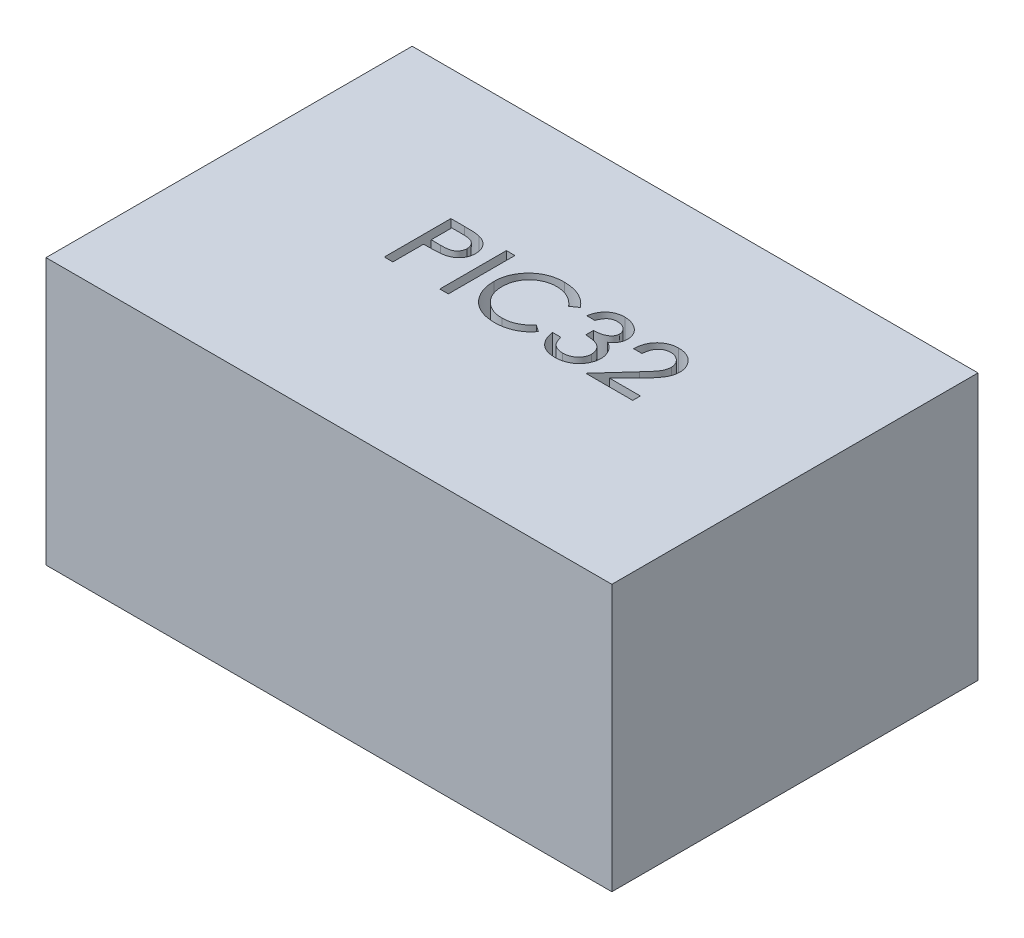
from build123d import *

# Parameters (mm, degrees)
SKETCH1_W           = 53.975
SKETCH1_H           = 34.925
BOSS_EXTRUDE1_DEPTH = 25.4
SKETCH2_W           = 0.814102564
SKETCH2_H           = 6.35
CUT_EXTRUDE1_DEPTH  = 12.7


with BuildPart() as part:
    # Sketch1 → Boss-Extrude1 (new body)
    with BuildSketch(Plane(origin=(0, 0, 0), x_dir=(1, 0, 0), z_dir=(0, 1, 0))):
        Rectangle(SKETCH1_W, SKETCH1_H)
    extrude(amount=BOSS_EXTRUDE1_DEPTH)

    # Sketch2 → Cut-Extrude1 (cut, symmetric)
    # profile 1 of 5: a face of its own
    with BuildSketch(Plane(origin=(0, 25.4, 0), x_dir=(1, 0, 0), z_dir=(0, 1, 0))):
        with BuildLine():
            Line((-10.902195921, 5.074435246), (-9.600903853, 5.074435246))
            add(Edge.make_bspline(
                [(-9.600903853, 5.074435246), (-9.514824462, 5.074388351), (-9.349857019, 5.07429848), (-9.113276063, 5.068208505), (-8.898643863, 5.062952351), (-8.705643287, 5.052849575), (-8.534713751, 5.039010709), (-8.385793895, 5.02273786), (-8.258723822, 5.0044354), (-8.182090609, 4.987888516), (-8.146967555, 4.980304637)],
                knots=[0, 0, 0, 0, 1.415450773, 2.712650385, 3.891531898, 4.945867971, 5.890285756, 6.71109784, 7.409261617, 8, 8, 8, 8], degree=3))
            add(Edge.make_bspline(
                [(-8.146967555, 4.980304637), (-8.097523531, 4.967589826), (-7.999985627, 4.942507403), (-7.860551564, 4.89080511), (-7.728247474, 4.832056113), (-7.603525068, 4.765227141), (-7.487658334, 4.688043262), (-7.378147508, 4.604184186), (-7.278360977, 4.509408439), (-7.184880136, 4.408313803), (-7.102859509, 4.298591196), (-7.029368789, 4.1839533), (-6.96845616, 4.062735032), (-6.918396285, 3.935387282), (-6.879262671, 3.802574016), (-6.851113297, 3.663872069), (-6.834198642, 3.519585595), (-6.832531973, 3.421259693), (-6.8316831, 3.371180037)],
                knots=[0, 0, 0, 0, 1.085641105, 2.141637125, 3.15936318, 4.164535163, 5.147931294, 6.118832473, 7.09541784, 8.072503165, 9.045079613, 10.006206652, 10.966486436, 11.926469503, 12.914201526, 13.908586125, 14.934794539, 16, 16, 16, 16], degree=3))
            add(Edge.make_bspline(
                [(-6.8316831, 3.371180037), (-6.832550597, 3.321102715), (-6.834261132, 3.222360009), (-6.851068973, 3.07721097), (-6.879243857, 2.938220887), (-6.917228852, 2.804775747), (-6.967149563, 2.677705467), (-7.026800679, 2.555937274), (-7.09890744, 2.440850774), (-7.18122581, 2.331647144), (-7.27418674, 2.230004609), (-7.376442969, 2.136308965), (-7.489338622, 2.052196567), (-7.611715825, 1.976157687), (-7.74314815, 1.90685894), (-7.88495782, 1.847254412), (-8.036512153, 1.796465677), (-8.14169428, 1.769459915), (-8.195304895, 1.755695262)],
                knots=[0, 0, 0, 0, 1.042501879, 2.055610221, 3.037454288, 3.993184118, 4.940927036, 5.876790881, 6.812738028, 7.76458517, 8.720845088, 9.677105007, 10.648370915, 11.647960469, 12.67482723, 13.739162042, 14.847666245, 16, 16, 16, 16], degree=3))
            add(Edge.make_bspline(
                [(-8.195304895, 1.755695262), (-8.234650914, 1.747164761), (-8.320483441, 1.728555651), (-8.462917357, 1.70919154), (-8.628881943, 1.693327316), (-8.818901744, 1.679525148), (-9.032197868, 1.667931203), (-9.269716408, 1.661029605), (-9.530915653, 1.655460528), (-9.713263315, 1.655292171), (-9.8082456, 1.655204476)],
                knots=[0, 0, 0, 0, 0.596754895, 1.30180848, 2.129432098, 3.068723067, 4.126429569, 5.296393252, 6.591729958, 8, 8, 8, 8], degree=3))
            Line((-9.8082456, 1.655204476), (-10.088093357, 1.655204476))
            Line((-10.088093357, 1.655204476), (-10.088093357, -1.275564754))
            Line((-10.088093357, -1.275564754), (-10.902195921, -1.275564754))
            Line((-10.902195921, -1.275564754), (-10.902195921, 5.074435246))
        make_face()
        with BuildLine():
            Line((-10.088093357, 4.341742938), (-10.088093357, 2.385352714))
            Line((-10.088093357, 2.385352714), (-9.172227972, 2.375176431))
            add(Edge.make_bspline(
                [(-9.172227972, 2.375176431), (-9.120496604, 2.375858578), (-9.020826548, 2.37717286), (-8.876994868, 2.381736201), (-8.744700269, 2.391010883), (-8.623687201, 2.401827772), (-8.513711204, 2.416993101), (-8.415267379, 2.435920165), (-8.327516326, 2.457185747), (-8.227171748, 2.490619949), (-8.114851667, 2.542824808), (-7.995443152, 2.622478626), (-7.890188663, 2.717738722), (-7.803264328, 2.829859669), (-7.733311223, 2.95339489), (-7.681313314, 3.085431234), (-7.651881563, 3.225724137), (-7.647834845, 3.321439534), (-7.645785664, 3.369908002)],
                knots=[0, 0, 0, 0, 1.196816259, 2.305888068, 3.328295896, 4.264290022, 5.116006351, 5.89509982, 6.582615619, 7.202969204, 8.339503699, 9.435837163, 10.511976311, 11.608836183, 12.702577786, 13.786378287, 14.879063815, 16, 16, 16, 16], degree=3))
            add(Edge.make_bspline(
                [(-7.645785664, 3.369908002), (-7.647849648, 3.416685044), (-7.651943481, 3.509465549), (-7.681529081, 3.645922061), (-7.733550987, 3.775355288), (-7.803618031, 3.897155168), (-7.888762653, 4.008482084), (-7.989620508, 4.104250759), (-8.103763682, 4.182520443), (-8.210325116, 4.232650792), (-8.305341029, 4.265274696), (-8.389083896, 4.284438962), (-8.483687749, 4.302357285), (-8.589740052, 4.317718328), (-8.707339469, 4.328796965), (-8.836344239, 4.335903311), (-8.976286691, 4.341472248), (-9.07342685, 4.341650393), (-9.123890632, 4.341742938)],
                knots=[0, 0, 0, 0, 1.113934591, 2.209447376, 3.306634974, 4.424089692, 5.547326231, 6.633252657, 7.723023745, 8.829884498, 9.427152571, 10.113060991, 10.873719268, 11.720735618, 12.664423995, 13.686322671, 14.798057257, 16, 16, 16, 16], degree=3))
            Line((-9.123890632, 4.341742938), (-10.088093357, 4.341742938))
        make_face(mode=Mode.SUBTRACT)
    # profile 2 of 5: a face of its own
    with BuildSketch(Plane(origin=(0, 25.4, 0), x_dir=(1, 0, 0), z_dir=(0, 1, 0))):
        with Locations((-5.203477972, 1.899435246)):
            Rectangle(SKETCH2_W, SKETCH2_H)
    # profile 3 of 5: a face of its own
    with BuildSketch(Plane(origin=(0, 25.4, 0), x_dir=(1, 0, 0), z_dir=(0, 1, 0))):
        with BuildLine():
            Line((2.611906643, 3.893986528), (1.963168663, 3.446230117))
            add(Edge.make_bspline(
                [(1.963168663, 3.446230117), (1.885468629, 3.531338961), (1.733361538, 3.697949684), (1.482878731, 3.916199451), (1.220737977, 4.099890851), (0.946570158, 4.248412324), (0.660084995, 4.364681107), (0.359775551, 4.445468475), (0.045328077, 4.495255906), (-0.168999921, 4.501422696), (-0.278157459, 4.504563451)],
                knots=[0, 0, 0, 0, 1.078723025, 2.111729107, 3.104379151, 4.071093171, 5.02612831, 5.993405043, 6.978038489, 8, 8, 8, 8], degree=3))
            add(Edge.make_bspline(
                [(-0.278157459, 4.504563451), (-0.335023582, 4.503743797), (-0.448153026, 4.502113179), (-0.615797538, 4.484185671), (-0.780877808, 4.459647916), (-0.943238517, 4.422365329), (-1.10259123, 4.373625309), (-1.260021703, 4.317101705), (-1.413145837, 4.24709159), (-1.563449055, 4.169275786), (-1.708676189, 4.081750251), (-1.84546725, 3.984537553), (-1.976310964, 3.881981501), (-2.09750817, 3.769233242), (-2.210164888, 3.648271543), (-2.316748895, 3.520618606), (-2.414566282, 3.384614029), (-2.503241072, 3.240665541), (-2.58412604, 3.090917933), (-2.652005891, 2.934273692), (-2.710938451, 2.773390161), (-2.759844531, 2.607429594), (-2.796015802, 2.435889301), (-2.822836294, 2.259236217), (-2.840023733, 2.077861626), (-2.841723447, 1.955019082), (-2.842580536, 1.893075069)],
                knots=[0, 0, 0, 0, 1.002068956, 1.993515617, 2.969284448, 3.943018425, 4.926742606, 5.905741285, 6.889351865, 7.892340394, 8.888397413, 9.875523532, 10.849114049, 11.817064186, 12.790109362, 13.76151668, 14.746886598, 15.740472426, 16.740336546, 17.744438579, 18.747064952, 19.759451636, 20.791569268, 21.834966327, 22.908270136, 24, 24, 24, 24], degree=3))
            add(Edge.make_bspline(
                [(-2.842580536, 1.893075069), (-2.84061831, 1.800090109), (-2.836777192, 1.618069225), (-2.799650671, 1.351544858), (-2.741720189, 1.097556421), (-2.660287407, 0.85612397), (-2.555066606, 0.627521775), (-2.426337857, 0.412125402), (-2.273360418, 0.209409653), (-2.098670314, 0.021994779), (-1.908241597, -0.150003719), (-1.701851257, -0.297163723), (-1.486566788, -0.424952793), (-1.25813327, -0.526416132), (-1.019778653, -0.607111417), (-0.769658205, -0.664272852), (-0.508548881, -0.699345218), (-0.330421532, -0.703555592), (-0.239996402, -0.70569296)],
                knots=[0, 0, 0, 0, 1.083728652, 2.12143175, 3.131304262, 4.117911469, 5.086904967, 6.060353746, 7.03835, 8.042493243, 9.043967071, 10.025107856, 10.993520914, 11.958418665, 12.934074928, 13.923564625, 14.94591178, 16, 16, 16, 16], degree=3))
            add(Edge.make_bspline(
                [(-0.239996402, -0.70569296), (-0.135064162, -0.702608446), (0.072183753, -0.696516334), (0.376916021, -0.645202209), (0.670533207, -0.562320834), (0.95335233, -0.445483943), (1.22560423, -0.295839559), (1.486009917, -0.112237076), (1.736020695, 0.103663285), (1.887985346, 0.268386958), (1.965712733, 0.352640374)],
                knots=[0, 0, 0, 0, 0.996377973, 1.967910503, 2.926842387, 3.889624876, 4.868586907, 5.872161968, 6.91164629, 8, 8, 8, 8], degree=3))
            Line((1.965712733, 0.352640374), (2.611906643, -0.092571966))
            add(Edge.make_bspline(
                [(2.611906643, -0.092571966), (2.570074819, -0.145621801), (2.486960424, -0.251024925), (2.352736892, -0.400113556), (2.211751905, -0.540330824), (2.062617123, -0.670376129), (1.905492104, -0.790122982), (1.741113048, -0.900957923), (1.569637916, -1.002704668), (1.391160388, -1.094274454), (1.206697237, -1.176230592), (1.015871847, -1.245247257), (0.820513086, -1.306131263), (0.61889839, -1.3537967), (0.411814815, -1.392428195), (0.198941635, -1.418357875), (-0.018790348, -1.435908104), (-0.165758874, -1.437553923), (-0.239996402, -1.438385267)],
                knots=[0, 0, 0, 0, 0.990136069, 1.967271632, 2.938597646, 3.903378639, 4.8655934, 5.832714132, 6.808088679, 7.786607084, 8.77175572, 9.76479442, 10.759640537, 11.769709565, 12.799869661, 13.846050076, 14.911985293, 16, 16, 16, 16], degree=3))
            add(Edge.make_bspline(
                [(-0.239996402, -1.438385267), (-0.3082935, -1.437922416), (-0.442919466, -1.437010052), (-0.641876401, -1.421680646), (-0.83556108, -1.400951734), (-1.02345143, -1.369853332), (-1.206434045, -1.332612548), (-1.383015359, -1.283235705), (-1.555591083, -1.228156655), (-1.72165023, -1.161546242), (-1.882444876, -1.087472192), (-2.038540678, -1.00628832), (-2.188401967, -0.914687667), (-2.332153485, -0.813559907), (-2.471487297, -0.705450857), (-2.604994198, -0.587953433), (-2.734063286, -0.462563867), (-2.813892327, -0.372106633), (-2.854028853, -0.326626453)],
                knots=[0, 0, 0, 0, 1.116169561, 2.200172621, 3.260333751, 4.299600589, 5.312386579, 6.311224183, 7.295427787, 8.272379731, 9.233840239, 10.188782295, 11.146938977, 12.102635432, 13.060741968, 14.028403985, 15.00871894, 16, 16, 16, 16], degree=3))
            add(Edge.make_bspline(
                [(-2.854028853, -0.326626453), (-2.918369196, -0.247661201), (-3.04590246, -0.091138934), (-3.208445635, 0.16327973), (-3.34864329, 0.428076885), (-3.46003588, 0.707025231), (-3.548082833, 0.996834986), (-3.612256823, 1.298390469), (-3.649233027, 1.6127232), (-3.654171998, 1.826408866), (-3.6566831, 1.935052233)],
                knots=[0, 0, 0, 0, 0.995996121, 1.974230005, 2.94855815, 3.923972302, 4.908363682, 5.909282248, 6.937024559, 8, 8, 8, 8], degree=3))
            add(Edge.make_bspline(
                [(-3.6566831, 1.935052233), (-3.653848179, 2.049266159), (-3.648270648, 2.273974929), (-3.601297472, 2.603839799), (-3.52476047, 2.919387573), (-3.419562379, 3.22197991), (-3.280164128, 3.509141152), (-3.113923964, 3.784582009), (-2.912882188, 4.043170314), (-2.686931963, 4.287145352), (-2.438339413, 4.510426123), (-2.169878224, 4.704046663), (-1.887281332, 4.8695051), (-1.589508016, 5.005045834), (-1.275751423, 5.110046598), (-0.946530252, 5.182686622), (-0.602550399, 5.228682583), (-0.368196145, 5.234363798), (-0.248900648, 5.237255758)],
                knots=[0, 0, 0, 0, 1.034323922, 2.034967744, 3.011348252, 3.972313581, 4.931003742, 5.898099022, 6.881526582, 7.89265862, 8.907395938, 9.903191422, 10.886146247, 11.869423756, 12.861842533, 13.877618994, 14.91962492, 16, 16, 16, 16], degree=3))
            add(Edge.make_bspline(
                [(-0.248900648, 5.237255758), (-0.17382015, 5.2363864), (-0.025167776, 5.23466515), (0.195226394, 5.217658405), (0.410027598, 5.189743408), (0.619278732, 5.151291839), (0.823599144, 5.103777193), (1.021907476, 5.041822129), (1.215327411, 4.97104638), (1.402556985, 4.88933218), (1.58313676, 4.798429029), (1.755019474, 4.695878629), (1.919392802, 4.585616897), (2.074946539, 4.465345622), (2.222717478, 4.337047839), (2.361983937, 4.199246842), (2.492020312, 4.051383768), (2.571810732, 3.946627941), (2.611906643, 3.893986528)],
                knots=[0, 0, 0, 0, 1.097463626, 2.172875475, 3.229307817, 4.262776093, 5.282168658, 6.293918414, 7.298043722, 8.291879901, 9.278790577, 10.251524626, 11.216027204, 12.170719329, 13.124142787, 14.075306658, 15.032812027, 16, 16, 16, 16], degree=3))
        make_face()
    # profile 4 of 5: a face of its own
    with BuildSketch(Plane(origin=(0, 25.4, 0), x_dir=(1, 0, 0), z_dir=(0, 1, 0))):
        with BuildLine():
            Line((4.369859368, 3.527640374), (3.58882972, 3.527640374))
            add(Edge.make_bspline(
                [(3.58882972, 3.527640374), (3.604752851, 3.597876863), (3.635922108, 3.735363594), (3.698929378, 3.931768441), (3.769923944, 4.115445928), (3.851945242, 4.284992346), (3.946991138, 4.439085696), (4.049882579, 4.580699793), (4.165038323, 4.706881386), (4.28992991, 4.819375988), (4.423926826, 4.916554758), (4.563063886, 5.002762662), (4.708449256, 5.075042182), (4.859168015, 5.13560155), (5.015994314, 5.181438878), (5.178797973, 5.212399351), (5.346622986, 5.234148633), (5.460770437, 5.236212059), (5.518507204, 5.237255758)],
                knots=[0, 0, 0, 0, 1.225194122, 2.398296627, 3.506547767, 4.574817873, 5.598350885, 6.584148364, 7.54966307, 8.500147383, 9.439776218, 10.36307994, 11.282851771, 12.199447467, 13.124300948, 14.058371117, 15.017907346, 16, 16, 16, 16], degree=3))
            add(Edge.make_bspline(
                [(5.518507204, 5.237255758), (5.60814456, 5.234237191), (5.785569917, 5.228262333), (6.046941341, 5.183115299), (6.298048373, 5.105618827), (6.53655484, 5.000859886), (6.756959421, 4.872591768), (6.951891157, 4.722950139), (7.119535905, 4.555654437), (7.25504763, 4.370506795), (7.362356177, 4.176224529), (7.439027004, 3.976777668), (7.48778338, 3.774203594), (7.493612923, 3.637724436), (7.496522028, 3.569617537)],
                knots=[0, 0, 0, 0, 1.126551995, 2.229861531, 3.322496069, 4.422827045, 5.497949776, 6.520418829, 7.504194933, 8.464779191, 9.395175895, 10.286118409, 11.144725379, 12, 12, 12, 12], degree=3))
            add(Edge.make_bspline(
                [(7.496522028, 3.569617537), (7.494441536, 3.503735429), (7.490371477, 3.374850505), (7.45498152, 3.187490488), (7.398076247, 3.011728477), (7.316672329, 2.848294089), (7.212931429, 2.696860061), (7.084940541, 2.558734249), (6.935227071, 2.43139953), (6.822036663, 2.359827915), (6.76382972, 2.323022986)],
                knots=[0, 0, 0, 0, 1.039530957, 2.033630564, 2.999111873, 3.948297759, 4.906578666, 5.887513816, 6.913676835, 8, 8, 8, 8], degree=3))
            add(Edge.make_bspline(
                [(6.76382972, 2.323022986), (6.826724676, 2.29607549), (6.952222957, 2.242305448), (7.123043096, 2.127673079), (7.280073964, 1.990867224), (7.367883567, 1.882218091), (7.412567701, 1.826929236)],
                knots=[0, 0, 0, 0, 0.990740455, 1.976887035, 2.970487876, 4, 4, 4, 4], degree=3))
            add(Edge.make_bspline(
                [(7.412567701, 1.826929236), (7.444946518, 1.781961251), (7.508900544, 1.693141338), (7.593739108, 1.554413975), (7.66270058, 1.411358998), (7.722626002, 1.267585751), (7.76688053, 1.120404189), (7.79876913, 0.971099855), (7.818541365, 0.819159844), (7.820951952, 0.716924871), (7.822163054, 0.665561047)],
                knots=[0, 0, 0, 0, 1.060434252, 2.094549648, 3.107169572, 4.097295716, 5.072846837, 6.043796276, 7.017184609, 8, 8, 8, 8], degree=3))
            add(Edge.make_bspline(
                [(7.822163054, 0.665561047), (7.818968016, 0.57705359), (7.812559578, 0.399529989), (7.75281468, 0.136676383), (7.661327575, -0.122257525), (7.554222532, -0.329787698), (7.453382492, -0.490711079), (7.368342528, -0.605566203), (7.276793605, -0.71458372), (7.176329329, -0.815178558), (7.070140228, -0.910967547), (6.954831863, -0.998730969), (6.832439589, -1.080221485), (6.703554802, -1.155148851), (6.568017179, -1.220944132), (6.42876659, -1.280116963), (6.284122253, -1.327568289), (6.136784984, -1.369376272), (5.984297869, -1.398930463), (5.828244562, -1.422676925), (5.667524491, -1.434793225), (5.559228079, -1.437179619), (5.504514816, -1.438385267)],
                knots=[0, 0, 0, 0, 1.521749033, 3.052244174, 4.617626532, 6.240122497, 7.060311358, 7.885196768, 8.698339091, 9.508724546, 10.330730427, 11.158549718, 12.000758621, 12.860902525, 13.722748307, 14.593084173, 15.463328201, 16.341708233, 17.227848997, 18.135261118, 19.057900949, 20, 20, 20, 20], degree=3))
            add(Edge.make_bspline(
                [(5.504514816, -1.438385267), (5.435348038, -1.436841195), (5.299216436, -1.433802206), (5.099620746, -1.412210353), (4.908513581, -1.37531733), (4.726506125, -1.322924011), (4.552411997, -1.257060682), (4.387945185, -1.175001495), (4.231756765, -1.079338928), (4.084626961, -0.968348593), (3.948552654, -0.840971312), (3.823715003, -0.697406793), (3.713457518, -0.53574817), (3.613791313, -0.358475373), (3.527441261, -0.163564257), (3.452954403, 0.047416334), (3.389783191, 0.275155086), (3.359955594, 0.433788817), (3.344598951, 0.515460887)],
                knots=[0, 0, 0, 0, 1.031951552, 2.031050468, 2.99141865, 3.932589319, 4.853771667, 5.764839348, 6.670884665, 7.583203617, 8.509779947, 9.447179227, 10.415909331, 11.424319639, 12.477825485, 13.592421652, 14.760465984, 16, 16, 16, 16], degree=3))
            Line((3.344598951, 0.515460887), (4.134532845, 0.515460887))
            add(Edge.make_bspline(
                [(4.134532845, 0.515460887), (4.150277359, 0.461500591), (4.180444469, 0.358110538), (4.229899568, 0.210451128), (4.283101027, 0.077761904), (4.337919147, -0.041739477), (4.394629741, -0.147571901), (4.45446184, -0.239564633), (4.516186062, -0.318577841), (4.562656975, -0.361915075), (4.584833326, -0.382596004)],
                knots=[0, 0, 0, 0, 1.326285875, 2.54121601, 3.672658499, 4.697761427, 5.642367002, 6.502616728, 7.285434817, 8, 8, 8, 8], degree=3))
            add(Edge.make_bspline(
                [(4.584833326, -0.382596004), (4.616934168, -0.408799272), (4.680511615, -0.460696256), (4.785206349, -0.524869349), (4.893171078, -0.582318845), (5.008262661, -0.625548028), (5.1269889, -0.662087092), (5.25136693, -0.687284301), (5.380728495, -0.702833936), (5.468853431, -0.704732724), (5.513419063, -0.70569296)],
                knots=[0, 0, 0, 0, 0.989076215, 1.958918776, 2.928708407, 3.907140108, 4.891221483, 5.894723991, 6.935341563, 8, 8, 8, 8], degree=3))
            add(Edge.make_bspline(
                [(5.513419063, -0.70569296), (5.568583508, -0.704390611), (5.67666153, -0.701839053), (5.834244679, -0.684309271), (5.983665699, -0.653473471), (6.124267511, -0.610604686), (6.256981889, -0.555548417), (6.380419071, -0.487864949), (6.496041892, -0.408793936), (6.601004642, -0.317040769), (6.695047434, -0.217461584), (6.778909127, -0.113564892), (6.850571403, -0.005862212), (6.907980744, 0.107032841), (6.953214165, 0.223729557), (6.984531623, 0.344552275), (7.004607282, 0.469422735), (7.006898037, 0.553968216), (7.00806049, 0.596871143)],
                knots=[0, 0, 0, 0, 1.196856166, 2.344877135, 3.434653565, 4.502660904, 5.529498559, 6.546397239, 7.551828815, 8.562675341, 9.564818567, 10.520268272, 11.456705045, 12.365995596, 13.262962725, 14.166698094, 15.069683942, 16, 16, 16, 16], degree=3))
            add(Edge.make_bspline(
                [(7.00806049, 0.596871143), (7.005530339, 0.653464881), (7.000473453, 0.766575953), (6.962091432, 0.932899206), (6.900532143, 1.094200077), (6.813574785, 1.24670346), (6.707732891, 1.389571789), (6.580783004, 1.514714996), (6.436040456, 1.621636784), (6.301030424, 1.695559005), (6.17869733, 1.744410451), (6.072022331, 1.778401125), (5.950881723, 1.808591926), (5.815842049, 1.835041182), (5.666448206, 1.857797509), (5.502651975, 1.876583479), (5.32402339, 1.891571602), (5.200090952, 1.899254771), (5.135624592, 1.903251351)],
                knots=[0, 0, 0, 0, 1.058801672, 2.116173898, 3.179133807, 4.280986043, 5.392377071, 6.498225676, 7.604871823, 8.752253925, 9.368447799, 10.068883315, 10.846735517, 11.704571958, 12.644304815, 13.675272135, 14.790738352, 16, 16, 16, 16], degree=3))
            Line((5.135624592, 1.903251351), (5.135624592, 2.632127553))
            add(Edge.make_bspline(
                [(5.135624592, 2.632127553), (5.219658005, 2.633673692), (5.380976862, 2.636641814), (5.612574883, 2.663618596), (5.823351472, 2.707054376), (6.012283513, 2.769113289), (6.177084164, 2.845920526), (6.320041123, 2.928333964), (6.436788774, 3.02231656), (6.528752584, 3.124816384), (6.596352344, 3.235269301), (6.647598638, 3.348456428), (6.67598125, 3.46818513), (6.680260402, 3.549129374), (6.682419464, 3.589970101)],
                knots=[0, 0, 0, 0, 1.49683591, 2.87347434, 4.147795521, 5.325633569, 6.407353164, 7.383009189, 8.25851615, 9.066624807, 9.823413814, 10.557538392, 11.272200497, 12, 12, 12, 12], degree=3))
            add(Edge.make_bspline(
                [(6.682419464, 3.589970101), (6.681493825, 3.620146295), (6.679669385, 3.679623737), (6.663476901, 3.767525344), (6.638390463, 3.852600573), (6.602513402, 3.93468314), (6.555516544, 4.01303122), (6.499962961, 4.089429742), (6.432817259, 4.162131364), (6.357029129, 4.231413354), (6.274082551, 4.295919643), (6.184339798, 4.352472207), (6.088714076, 4.399449535), (5.987198147, 4.437640378), (5.88049855, 4.468295678), (5.767693411, 4.489798495), (5.649410265, 4.502737954), (5.568574023, 4.503947526), (5.527411451, 4.504563451)],
                knots=[0, 0, 0, 0, 0.88508993, 1.744517034, 2.61478088, 3.484243336, 4.365825862, 5.291885516, 6.252189795, 7.265246754, 8.303377192, 9.332440159, 10.373327524, 11.425096702, 12.51242353, 13.62794981, 14.792129802, 16, 16, 16, 16], degree=3))
            add(Edge.make_bspline(
                [(5.527411451, 4.504563451), (5.468306083, 4.502006485), (5.35280042, 4.497009579), (5.184925794, 4.461122901), (5.029068674, 4.398669997), (4.907538933, 4.327507963), (4.816237191, 4.255349777), (4.749192809, 4.187600811), (4.684028441, 4.107121547), (4.617596972, 4.016033243), (4.553891569, 3.911362967), (4.490910825, 3.794920624), (4.4281707, 3.666033496), (4.389772641, 3.574901513), (4.369859368, 3.527640374)],
                knots=[0, 0, 0, 0, 1.30644707, 2.553102055, 3.773430717, 5.004978473, 5.652102429, 6.34150733, 7.107309491, 7.939915375, 8.832283585, 9.813897121, 10.866284818, 12, 12, 12, 12], degree=3))
        make_face()
    # profile 5 of 5: a face of its own
    with BuildSketch(Plane(origin=(0, 25.4, 0), x_dir=(1, 0, 0), z_dir=(0, 1, 0))):
        with BuildLine():
            Line((9.360053679, 3.039178835), (8.554855361, 3.039178835))
            add(Edge.make_bspline(
                [(8.554855361, 3.039178835), (8.55863762, 3.121112094), (8.5660352, 3.281362306), (8.598884266, 3.51486477), (8.652097414, 3.734883655), (8.719263639, 3.943284133), (8.808861512, 4.137461089), (8.912239535, 4.320799523), (9.037040561, 4.489457024), (9.178072538, 4.643700393), (9.331167731, 4.783836496), (9.495745779, 4.904673196), (9.669024808, 5.007643907), (9.851038892, 5.09166869), (10.042144486, 5.156727474), (10.241796865, 5.204069121), (10.450632944, 5.232543997), (10.592991208, 5.235670653), (10.665161852, 5.237255758)],
                knots=[0, 0, 0, 0, 1.154964179, 2.258951466, 3.315045469, 4.34063582, 5.337653555, 6.322213479, 7.300594401, 8.285733883, 9.262436119, 10.219305053, 11.156568068, 12.097250375, 13.037875795, 13.995471444, 14.983774372, 16, 16, 16, 16], degree=3))
            add(Edge.make_bspline(
                [(10.665161852, 5.237255758), (10.740724671, 5.23571007), (10.888999817, 5.232677003), (11.104924143, 5.20413547), (11.309276752, 5.158112269), (11.50211748, 5.095261122), (11.683094983, 5.011338471), (11.852566139, 4.910137009), (12.008901908, 4.788496507), (12.153236966, 4.65238838), (12.280722144, 4.502668319), (12.395867442, 4.348738312), (12.49104618, 4.187476482), (12.57078197, 4.021827507), (12.632139917, 3.850431836), (12.675470708, 3.673986974), (12.701443908, 3.492373026), (12.704988973, 3.369567568), (12.706778438, 3.307578274)],
                knots=[0, 0, 0, 0, 1.156722346, 2.269809107, 3.328396062, 4.361258308, 5.3694338, 6.377253737, 7.377324894, 8.397019439, 9.4098266, 10.385180797, 11.337325354, 12.27255833, 13.196816462, 14.119704983, 15.050871513, 16, 16, 16, 16], degree=3))
            add(Edge.make_bspline(
                [(12.706778438, 3.307578274), (12.703522153, 3.220865426), (12.69705419, 3.048627625), (12.647248875, 2.793811683), (12.563520305, 2.54720306), (12.466805796, 2.346398961), (12.368990738, 2.184086147), (12.27922653, 2.050111495), (12.173776809, 1.905244227), (12.050380152, 1.750454093), (11.913943313, 1.582199438), (11.759046485, 1.404820707), (11.590483957, 1.214726744), (11.470267785, 1.086726259), (11.408030441, 1.020458883)],
                knots=[0, 0, 0, 0, 1.155755081, 2.295677249, 3.447123235, 4.6205014, 5.259503175, 5.973005395, 6.77029923, 7.648035671, 8.612336498, 9.658570495, 10.787814065, 12, 12, 12, 12], degree=3))
            Line((11.408030441, 1.020458883), (9.845971147, -0.542872447))
            Line((9.845971147, -0.542872447), (12.788188695, -0.542872447))
            Line((12.788188695, -0.542872447), (12.788188695, -1.275564754))
            Line((12.788188695, -1.275564754), (8.310624592, -1.275564754))
            Line((8.310624592, -1.275564754), (10.740211932, 1.407157601))
            add(Edge.make_bspline(
                [(10.740211932, 1.407157601), (10.798081482, 1.468874828), (10.909134205, 1.587311314), (11.065647297, 1.760683311), (11.206857144, 1.920963017), (11.333516591, 2.068034726), (11.442308944, 2.203875238), (11.536160933, 2.326486103), (11.614010136, 2.436446312), (11.694856905, 2.56587863), (11.77496776, 2.721032785), (11.843116615, 2.910299067), (11.884009267, 3.103580996), (11.889785591, 3.233611195), (11.892675874, 3.298674028)],
                knots=[0, 0, 0, 0, 1.341560447, 2.574479018, 3.703506985, 4.728875774, 5.651874962, 6.462761537, 7.177175968, 7.787249671, 8.88179658, 9.938774664, 10.968630673, 12, 12, 12, 12], degree=3))
            add(Edge.make_bspline(
                [(11.892675874, 3.298674028), (11.891963587, 3.339036546), (11.890554183, 3.418901962), (11.871339276, 3.535855287), (11.844271629, 3.649293504), (11.802407446, 3.757392869), (11.751968809, 3.862280119), (11.688879047, 3.962599358), (11.613119461, 4.057420016), (11.528844051, 4.148875499), (11.435633233, 4.231449441), (11.337180334, 4.305506189), (11.23227462, 4.365649903), (11.123784373, 4.418246633), (11.008337107, 4.455534274), (10.888770655, 4.483296839), (10.76414618, 4.502528529), (10.67922834, 4.503875999), (10.635905041, 4.504563451)],
                knots=[0, 0, 0, 0, 0.999432927, 1.977580462, 2.931018689, 3.885672852, 4.844657058, 5.812871023, 6.815890212, 7.849665183, 8.891901864, 9.898878619, 10.897592748, 11.885014695, 12.882178885, 13.896915602, 14.927050508, 16, 16, 16, 16], degree=3))
            add(Edge.make_bspline(
                [(10.635905041, 4.504563451), (10.594717799, 4.503718693), (10.513691681, 4.502056831), (10.394360667, 4.484910272), (10.279817668, 4.456992301), (10.16967628, 4.41826753), (10.063138768, 4.370492371), (9.962810152, 4.308599745), (9.867050594, 4.236599552), (9.774594127, 4.155790173), (9.69044808, 4.060984683), (9.615185691, 3.953306548), (9.548726031, 3.832638439), (9.491919347, 3.699191451), (9.444840873, 3.552615484), (9.407074689, 3.393088768), (9.377877779, 3.220541878), (9.366104956, 3.10075154), (9.360053679, 3.039178835)],
                knots=[0, 0, 0, 0, 0.911540883, 1.79324023, 2.663162255, 3.518366492, 4.375475705, 5.243419306, 6.122264358, 7.02676621, 7.957780629, 8.921596253, 9.930241338, 11.002848587, 12.128200329, 13.335197372, 14.630280975, 16, 16, 16, 16], degree=3))
        make_face()
    extrude(amount=CUT_EXTRUDE1_DEPTH, both=True, mode=Mode.SUBTRACT)


solid = part.part
